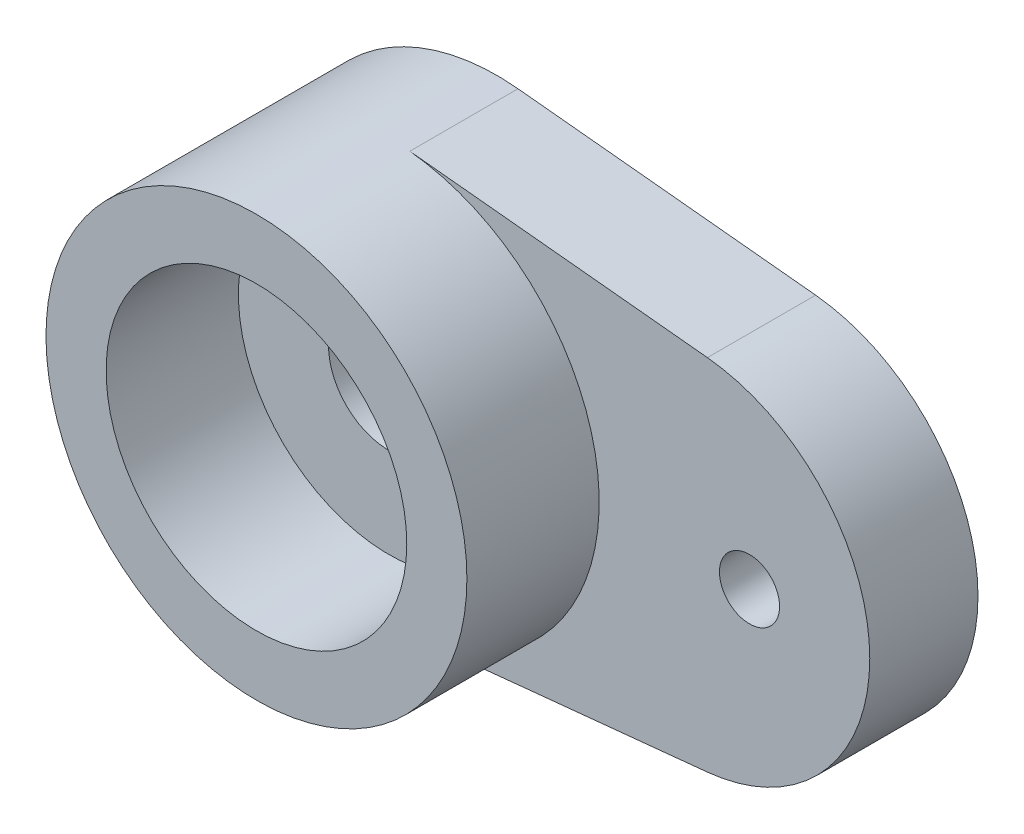
from build123d import *

# Parameters (mm, degrees)
SKETCH1_R           = 1
SKETCH1_R_2         = 0.5
BOSS_EXTRUDE3_DEPTH = 1.8
SKETCH4_R           = 3.5
SKETCH4_R_2         = 2.5
BOSS_EXTRUDE4_DEPTH = 2.2


with BuildPart() as part:
    # Sketch1 → Boss-Extrude3 (new body)
    with BuildSketch(Plane.XY):
        with BuildLine():
            Line((0.35, 3.48245603), (5.3, 2.984962311))
            ThreePointArc((5.3, 2.984962311), (8, 0), (5.3, -2.984962311))
            Line((5.3, -2.984962311), (0.35, -3.48245603))
            ThreePointArc((0.35, -3.48245603), (-3.5, 0), (0.35, 3.48245603))
        make_face()
        Circle(SKETCH1_R, mode=Mode.SUBTRACT)
        with Locations((6, 0)):
            Circle(SKETCH1_R_2, mode=Mode.SUBTRACT)
    extrude(amount=BOSS_EXTRUDE3_DEPTH)

    # Sketch4 → Boss-Extrude4 (add)
    with BuildSketch(Plane.XY.offset(1.8)):
        with Locations(Location((0, 0, 0), (0, 0, 275.739170477))):
            Circle(SKETCH4_R)
        Circle(SKETCH4_R_2, mode=Mode.SUBTRACT)
    extrude(amount=BOSS_EXTRUDE4_DEPTH)


solid = part.part
